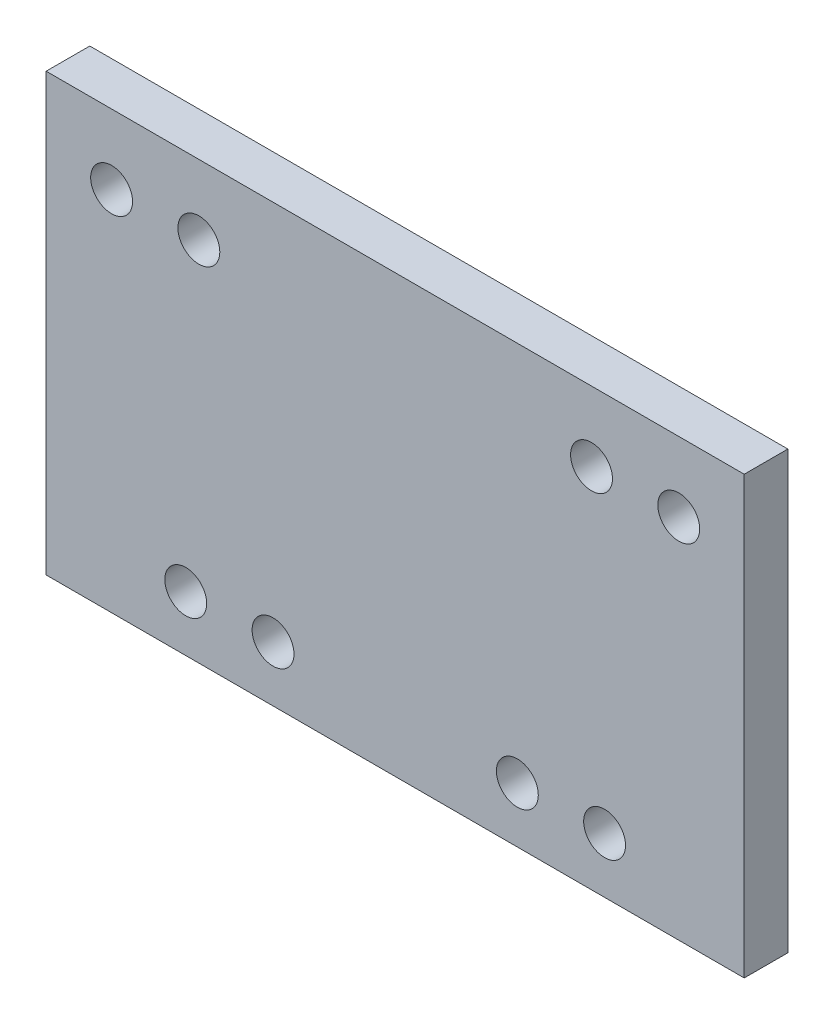
from build123d import *

# Parameters (mm, degrees)
SKETCH1_W            = 80
SKETCH1_H            = 50
BOSS_EXTRUDE1_DEPTH  = 5
M4_CLEARANCE_HOLE1_D = 4.8


with BuildPart() as part:
    # Sketch1 → Boss-Extrude1 (new body)
    with BuildSketch(Plane.XY):
        Rectangle(SKETCH1_W, SKETCH1_H)
    extrude(amount=BOSS_EXTRUDE1_DEPTH)

    # M4 Clearance Hole1 (through all)
    with Locations(Plane.XY.offset(5)):
        with Locations((-32.5, 17.0000001), (-22.5, 17.0000001), (-24, -18.65), (-14, -18.65), (14, -18.65), (24, -18.65), (22.5, 17.0000001), (32.5, 17.0000001)):
            Hole(M4_CLEARANCE_HOLE1_D / 2)


solid = part.part
